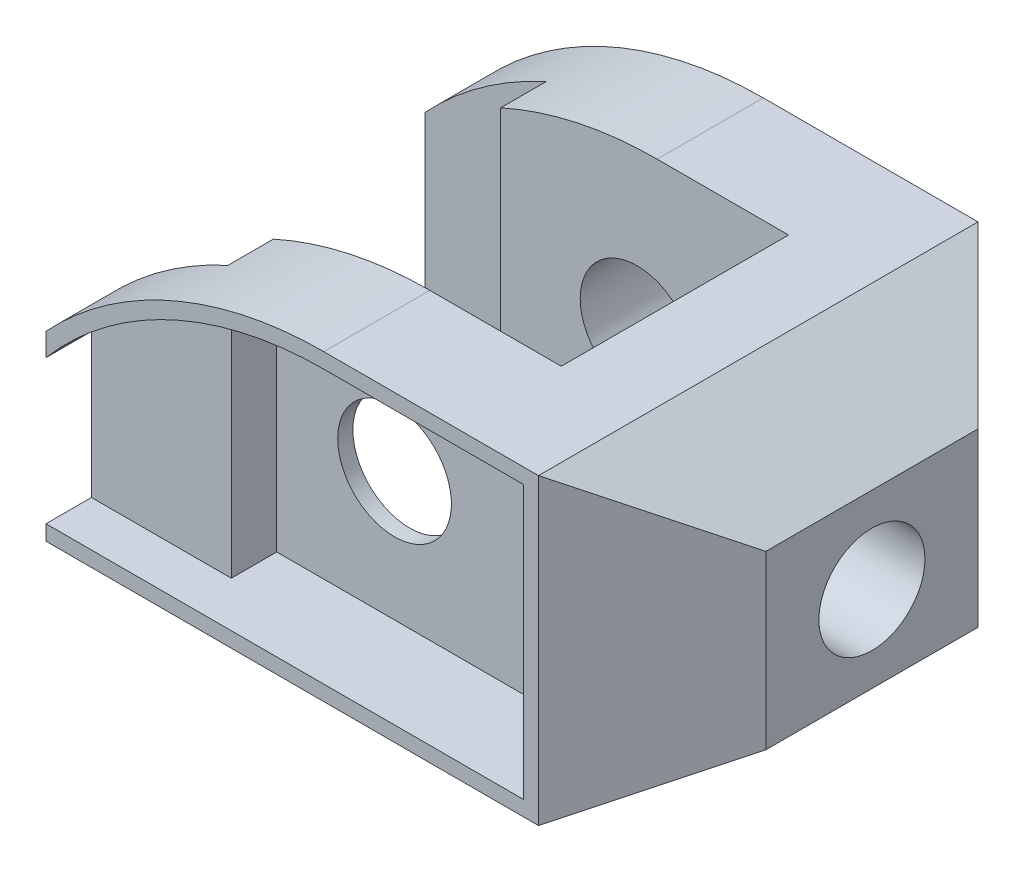
from build123d import *

# Parameters (mm, degrees)
SKETCH2_R           = 7.5
BOSS_EXTRUDE1_DEPTH = 29
CUT_EXTRUDE1_DEPTH  = 95.026591983
SKETCH4_R           = 7
CUT_EXTRUDE2_DEPTH  = 95.026591983
CUT_EXTRUDE5_DEPTH  = 6
CUT_EXTRUDE7_DEPTH  = 6


with BuildPart() as part:
    # Sketch2 → Boss-Extrude1 (new, symmetric)
    with BuildSketch(Plane.XY):
        with BuildLine():
            Line((0, 0), (0, 24))
            ThreePointArc((0, 24), (16.66060556, 35.82575695), (36.66060556, 40))
            Line((36.66060556, 40), (65, 40))
            Line((65, 40), (80, 31.339745962))
            Line((80, 31.339745962), (80, 8.660254038))
            Line((80, 8.660254038), (65, 0))
            Line((65, 0), (0, 0))
        make_face()
        with Locations(Location((34, 19, 0), (0, 0, 180))):
            Circle(SKETCH2_R, mode=Mode.SUBTRACT)
    extrude(amount=BOSS_EXTRUDE1_DEPTH, both=True)

    # Sketch3 → Cut-Extrude1 (cut, through all)
    with BuildSketch(Plane(origin=(0, 40, 0), x_dir=(1, 0, 0), z_dir=(0, 1, 0))):
        Polygon((65, 29), (80, 29), (80, 14), align=None)
        Polygon((0, 21), (16, 21), (16, 15), (54, 15), (54, -15), (16, -15), (16, -21), (0, -21), align=None)
        Polygon((80, -29), (80, -14), (65, -29), align=None)
    extrude(amount=-CUT_EXTRUDE1_DEPTH, mode=Mode.SUBTRACT)

    # Sketch4 → Cut-Extrude2 (cut, through all)
    with BuildSketch(Plane(origin=(80, 0, 0), x_dir=(0, 0, -1), z_dir=(1, 0, 0))):
        with Locations((0, 20)):
            Circle(SKETCH4_R)
    extrude(amount=-CUT_EXTRUDE2_DEPTH, mode=Mode.SUBTRACT)

    # Sketch5 → Cut-Extrude5 (cut)
    with BuildSketch(Plane.XY.offset(29)):
        with BuildLine():
            Line((0, 20.98386677), (0, 2))
            Line((0, 2), (63, 2))
            Line((63, 2), (63, 38))
            Line((63, 38), (36.66060556, 38))
            ThreePointArc((36.66060556, 38), (16.452013389, 33.538635744), (0, 20.98386677))
        make_face()
    extrude(amount=-CUT_EXTRUDE5_DEPTH, mode=Mode.SUBTRACT)

    # Sketch9 → Cut-Extrude7 (cut)
    with BuildSketch(Plane.XY.offset(23)):
        with BuildLine():
            Line((63, 2), (63, 38))
            Line((63, 38), (36.66060556, 38))
            ThreePointArc((36.66060556, 38), (27.381262347, 37.09451974), (18.452013389, 34.412241231))
            Line((18.452013389, 34.412241231), (18.452013389, 2))
            Line((18.452013389, 2), (63, 2))
        make_face()
    extrude(amount=-CUT_EXTRUDE7_DEPTH, mode=Mode.SUBTRACT)


solid = part.part
